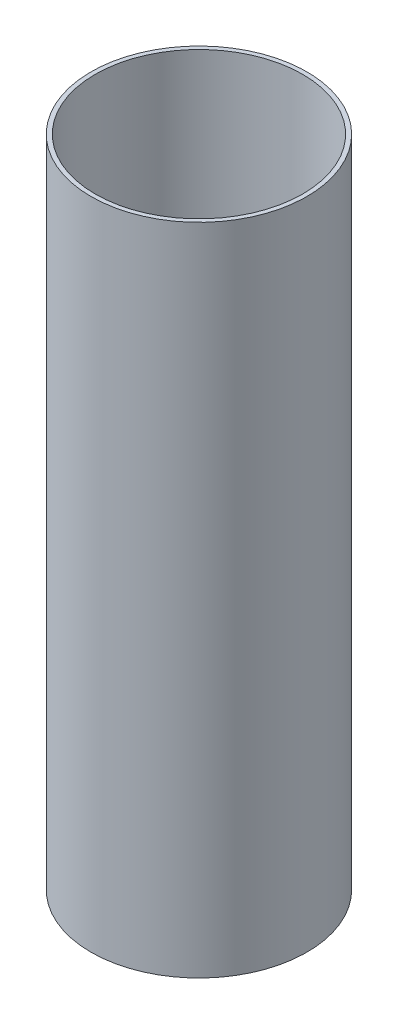
from build123d import *

# Parameters (mm, degrees)
BOSS_EXTRUDE1_DEPTH      = 115
BOSS_EXTRUDE1_DEPTH_BACK = 115
SKETCH1_R                = 37.95
SKETCH1_R_2              = 36.45


with BuildPart() as part:
    # Sketch1 → Boss-Extrude1 (new, two sides: drawn at the far end of the back side and taken through both)
    with BuildSketch(Plane(origin=(0, 0, 0), x_dir=(1, 0, 0), z_dir=(0, 1, 0)).offset(-BOSS_EXTRUDE1_DEPTH_BACK)):
        Circle(SKETCH1_R)
        Circle(SKETCH1_R_2, mode=Mode.SUBTRACT)
    extrude(amount=BOSS_EXTRUDE1_DEPTH + BOSS_EXTRUDE1_DEPTH_BACK)


solid = part.part
